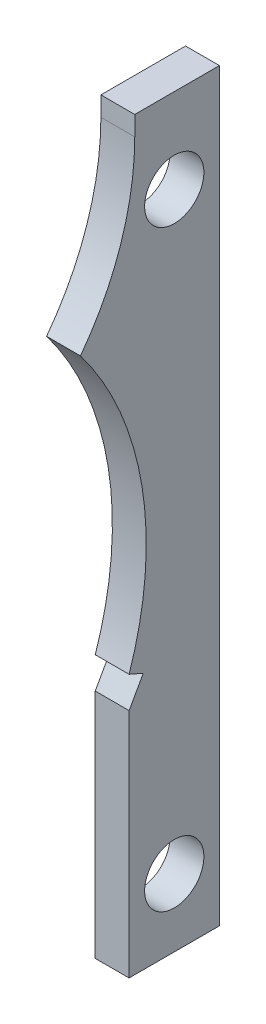
from build123d import *

# Parameters (mm, degrees)
BOSS_EXTRUDE1_DEPTH = 3
SKETCH3_R           = 5.25
CUT_EXTRUDE1_DEPTH  = 71.697893831


with BuildPart() as part:
    # Sketch1 → Boss-Extrude1 (new, symmetric)
    with BuildSketch(Plane(origin=(0, 0, 0), x_dir=(0, 0, -1), z_dir=(1, 0, 0))):
        with BuildLine():
            Line((0, 66), (-15, 66))
            Line((-15, 66), (-15, 62.56))
            ThreePointArc((-15, 62.56), (-17.468868001, 47.38033448), (-24.620970576, 33.765453531))
            ThreePointArc((-24.620970576, 33.765453531), (-13.706982887, 8.251900539), (-16, -19.403091525))
            Line((-16, -19.403091525), (-13.500700251, -20.50145429))
            Line((-13.500700251, -20.50145429), (-16, -24.97))
            Line((-16, -24.97), (-16, -66))
            Line((-16, -66), (0, -66))
            Line((0, -66), (0, 66))
        make_face()
    extrude(amount=BOSS_EXTRUDE1_DEPTH, both=True)

    # Sketch3 → Cut-Extrude1 (cut, through all)
    with BuildSketch(Plane(origin=(3, 0, 0), x_dir=(0, 0, -1), z_dir=(1, 0, 0))):
        with Locations((-8, 51)):
            Circle(SKETCH3_R)
        with Locations((-8, -54)):
            Circle(SKETCH3_R)
    extrude(amount=-CUT_EXTRUDE1_DEPTH, mode=Mode.SUBTRACT)


solid = part.part
